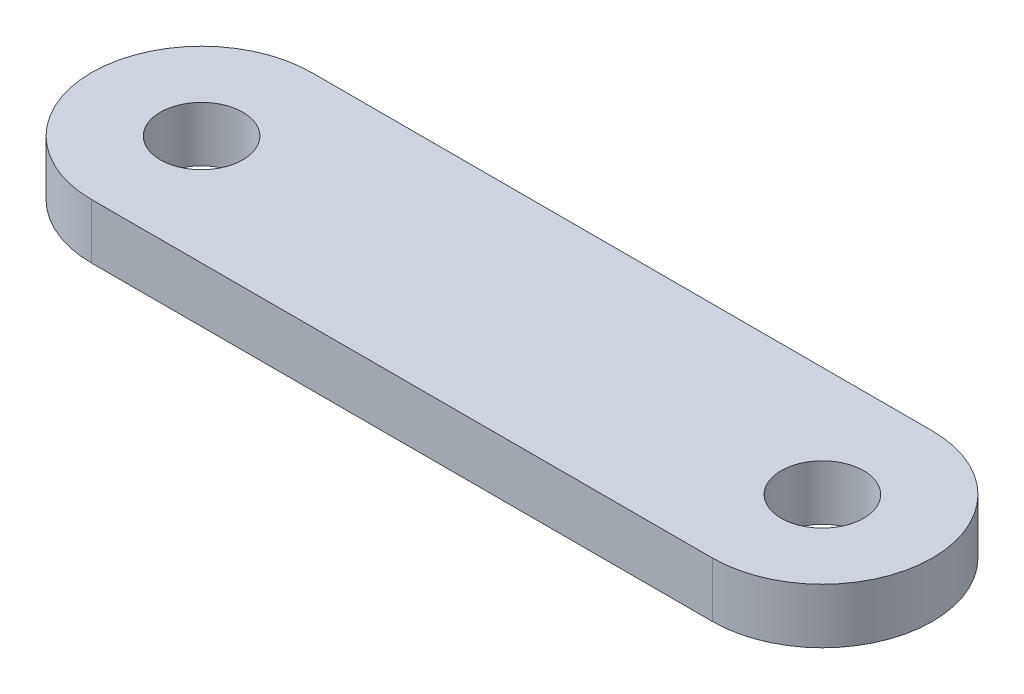
from build123d import *

# Parameters (mm, degrees)
SKETCH1_R           = 1.905
BOSS_EXTRUDE1_DEPTH = 2.54


with BuildPart() as part:
    # Sketch1 → Boss-Extrude1 (new body)
    with BuildSketch(Plane(origin=(0, 0, 0), x_dir=(1, 0, 0), z_dir=(0, 1, 0))):
        with BuildLine():
            Line((-14.33195, 5.08), (14.33195, 5.08))
            ThreePointArc((14.33195, 5.08), (19.41195, 0), (14.33195, -5.08))
            Line((14.33195, -5.08), (-14.33195, -5.08))
            ThreePointArc((-14.33195, -5.08), (-19.41195, 0), (-14.33195, 5.08))
        make_face()
        with Locations(Location((-14.33195, 0, 0), (0, 0, 270))):
            Circle(SKETCH1_R, mode=Mode.SUBTRACT)
        with Locations(Location((14.33195, 0, 0), (0, 0, 270))):
            Circle(SKETCH1_R, mode=Mode.SUBTRACT)
    extrude(amount=BOSS_EXTRUDE1_DEPTH)


solid = part.part
